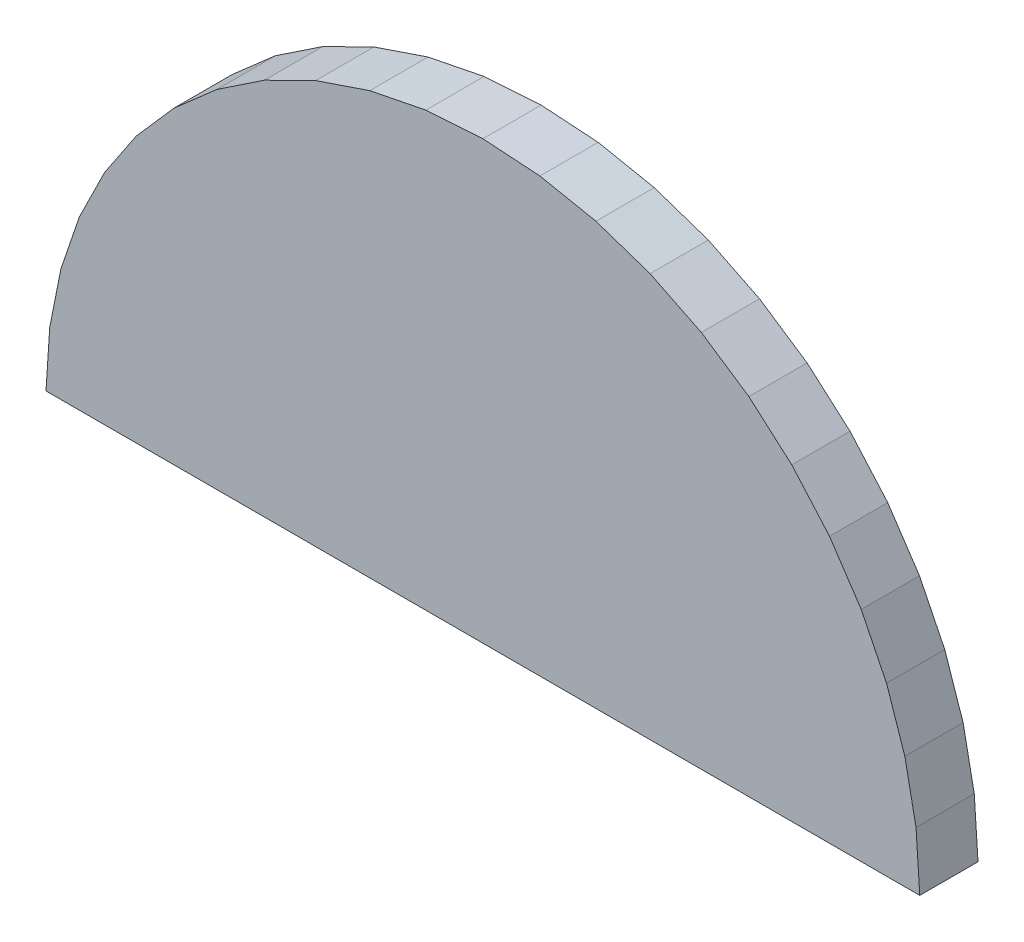
from build123d import *

# Parameters (mm, degrees)
SEMICIRCULAR_CAMERA_PLATFORM_DEPTH = 12


with BuildPart() as part:
    # 草图1 → Semicircular_camera_platform (new body)
    with BuildSketch(Plane.XY):
        Polygon((90, 0), (89.230037524, 11.7473573), (86.933324366, 23.293714059), (83.149157926, 34.441508913), (77.942286341, 45), (71.401800626, 54.788528611), (63.639610307, 63.639610307), (54.788528611, 71.401800626), (45, 77.942286341), (34.441508913, 83.149157926), (23.293714059, 86.933324366), (11.7473573, 89.230037524), (0, 90), (-11.7473573, 89.230037524), (-23.293714059, 86.933324366), (-34.441508913, 83.149157926), (-45, 77.942286341), (-54.788528611, 71.401800626), (-63.639610307, 63.639610307), (-71.401800626, 54.788528611), (-77.942286341, 45), (-83.149157926, 34.441508913), (-86.933324366, 23.293714059), (-89.230037524, 11.7473573), (-90, 0), align=None)
    extrude(amount=SEMICIRCULAR_CAMERA_PLATFORM_DEPTH)


solid = part.part
